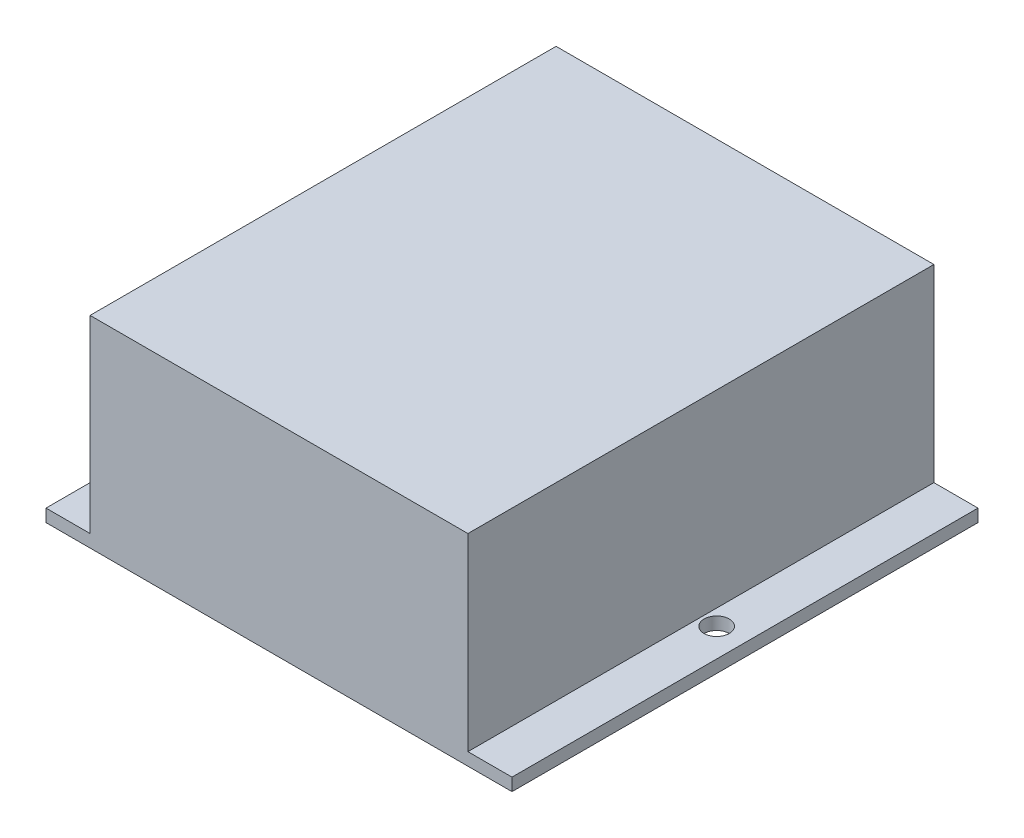
from build123d import *

# Parameters (mm, degrees)
SKETCH1_W           = 74
SKETCH1_H           = 74
BOSS_EXTRUDE1_DEPTH = 2
SKETCH2_W           = 60
SKETCH2_H           = 74
BOSS_EXTRUDE2_DEPTH = 30
SKETCH3_R           = 2
CUT_EXTRUDE1_DEPTH  = 2


with BuildPart() as part:
    # Sketch1 → Boss-Extrude1 (new body)
    with BuildSketch(Plane(origin=(0, 0, 0), x_dir=(1, 0, 0), z_dir=(0, 1, 0))):
        with Locations((37, 37)):
            Rectangle(SKETCH1_W, SKETCH1_H)
    extrude(amount=BOSS_EXTRUDE1_DEPTH)

    # Sketch2 → Boss-Extrude2 (add)
    with BuildSketch(Plane(origin=(0, 2, 0), x_dir=(1, 0, 0), z_dir=(0, 1, 0))):
        with Locations((37, 37)):
            Rectangle(SKETCH2_W, SKETCH2_H)
    extrude(amount=BOSS_EXTRUDE2_DEPTH)

    # Sketch3 → Cut-Extrude1 (cut)
    with BuildSketch(Plane.XZ):
        with Locations(Location((4.5, -37, 0), (0, 0, 270))):
            Circle(SKETCH3_R)
        with Locations(Location((69.5, -37, 0), (0, 0, 90))):
            Circle(SKETCH3_R)
    extrude(amount=-CUT_EXTRUDE1_DEPTH, mode=Mode.SUBTRACT)


solid = part.part
